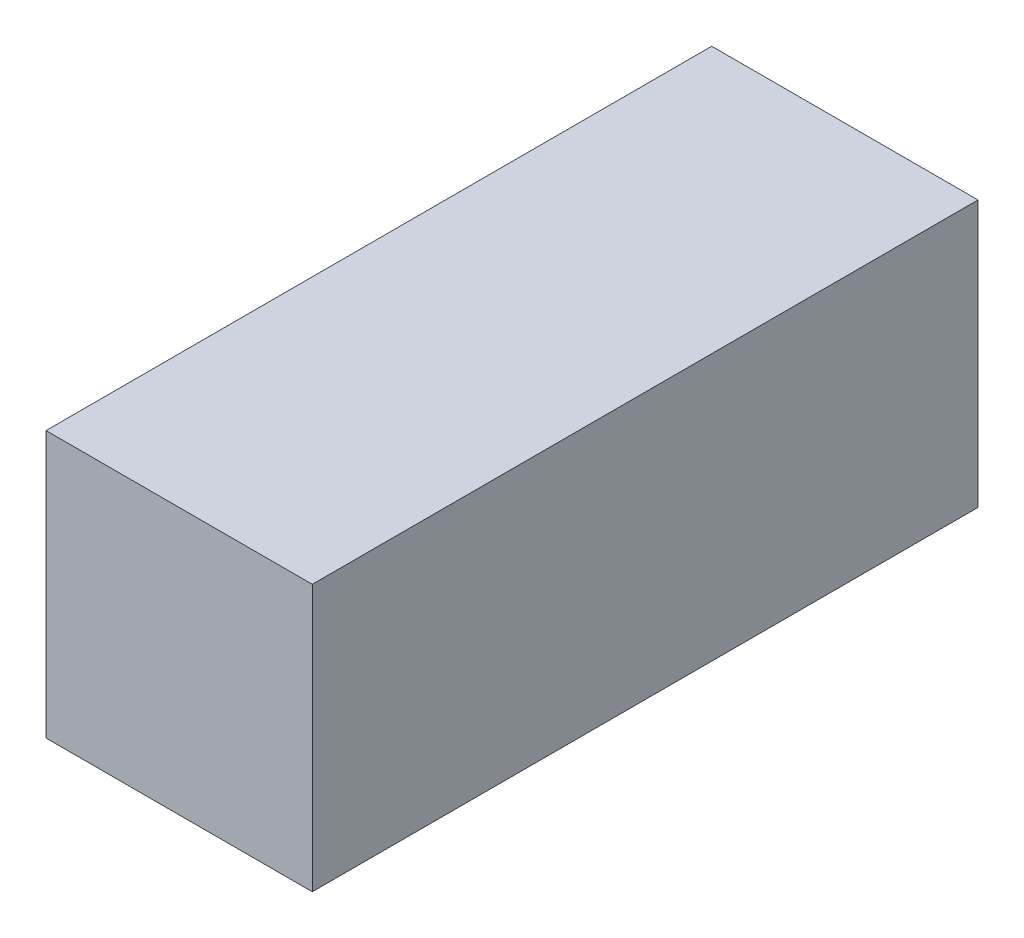
from build123d import *

# Parameters (mm, degrees)
SKETCH_1_W      = 40
SKETCH_1_H      = 40
EXTRUDE_1_DEPTH = 100


with BuildPart() as part:
    # 草图1 → 凸台-拉伸1 (new body)
    with BuildSketch(Plane.XY):
        with Locations((-1.840490798, 3.466585539)):
            Rectangle(SKETCH_1_W, SKETCH_1_H)
    extrude(amount=EXTRUDE_1_DEPTH)


solid = part.part
